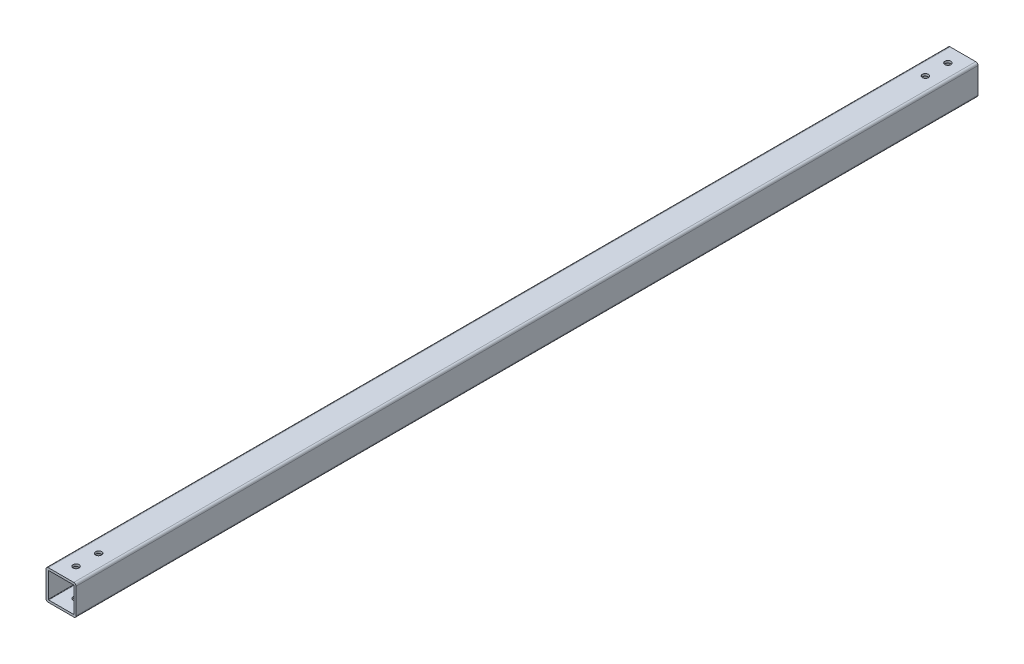
from build123d import *

# Parameters (mm, degrees)
SKETCH1_W                = 40
SKETCH1_H                = 40
SKETCH1_W_2              = 34
SKETCH1_H_2              = 34
EXTRUDE_THIN1_DEPTH      = 1200
FILLET1_R                = 0.5
FILLET2_R                = 3
F_8_0_8_DIAMETER_HOLE1_D = 8
SKETCH5_R                = 4
CUT_EXTRUDE1_DEPTH       = 1201.833044182


with BuildPart() as part:
    # Sketch1 → Extrude-Thin1 (new body)
    with BuildSketch(Plane.XY):
        Rectangle(SKETCH1_W, SKETCH1_H)
        Rectangle(SKETCH1_W_2, SKETCH1_H_2, mode=Mode.SUBTRACT)
    extrude(amount=EXTRUDE_THIN1_DEPTH)

    # Fillet1
    fillet1_edges = [part.edges().sort_by_distance(p)[0] for p in [
        (17, -17, 600),
        (17, 17, 600),
        (-17, 17, 600),
        (-17, -17, 600),
    ]]
    fillet(fillet1_edges, radius=FILLET1_R)

    # Fillet2
    fillet2_edges = [part.edges().sort_by_distance(p)[0] for p in [
        (20, -20, 600),
        (-20, -20, 600),
        (-20, 20, 600),
        (20, 20, 600),
    ]]
    fillet(fillet2_edges, radius=FILLET2_R)

    # Ø8.0 (8) Diameter Hole1 (through all)
    with Locations(Plane(origin=(0, 20, 0), x_dir=(1, 0, 0), z_dir=(0, 1, 0))):
        with Locations((0, -1180), (0, -20)):
            Hole(F_8_0_8_DIAMETER_HOLE1_D / 2)

    # Sketch5 → Cut-Extrude1 (cut, through all)
    with BuildSketch(Plane(origin=(0, 20, 0), x_dir=(1, 0, 0), z_dir=(0, 1, 0))):
        with Locations(Location((0, -1150, 0), (0, 0, 270))):
            Circle(SKETCH5_R)
        with Locations(Location((0, -50, 0), (0, 0, 270))):
            Circle(SKETCH5_R)
    extrude(amount=-CUT_EXTRUDE1_DEPTH, mode=Mode.SUBTRACT)


solid = part.part
